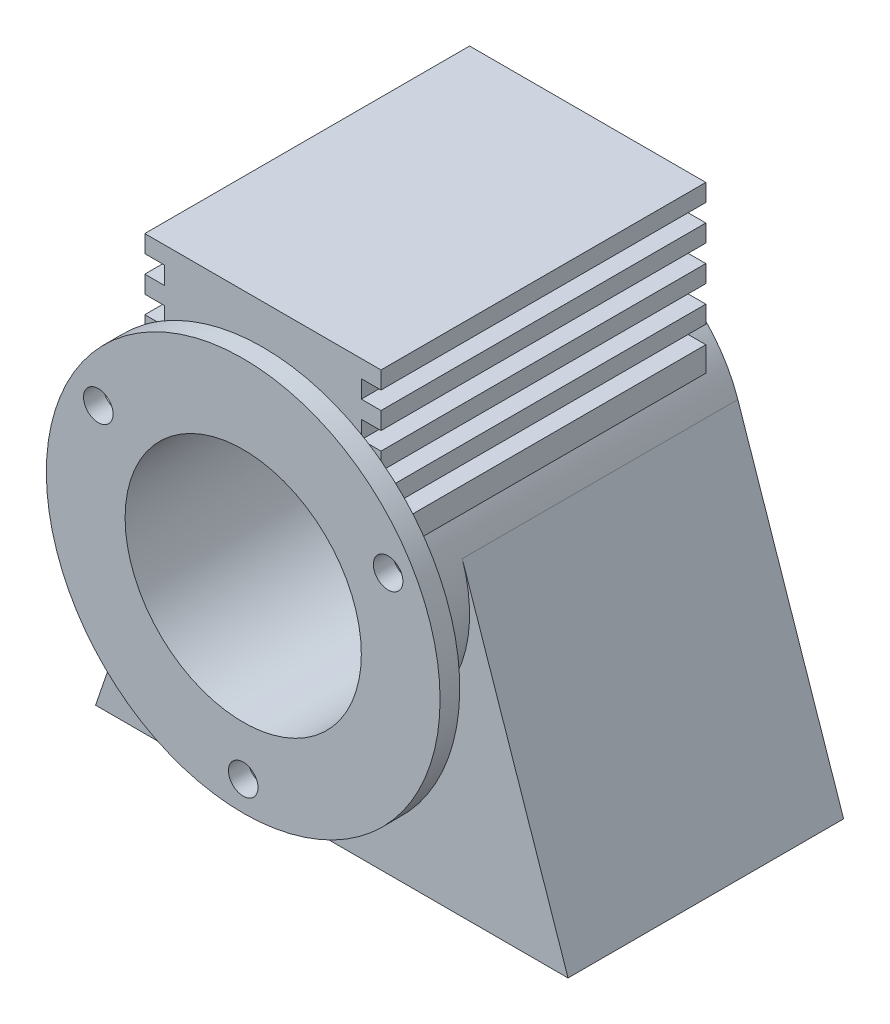
from build123d import *
from build123d.topology import SkipClean

# Parameters (mm, degrees)
BOSS_EXTRUDE1_DEPTH = 3.5
BOSS_EXTRUDE2_START = 1.75
SKETCH3_R           = 3.5
BOSS_EXTRUDE2_DEPTH = 1.75
BOSS_EXTRUDE3_START = 1.75
SKETCH3_3_R         = 5
BOSS_EXTRUDE3_DEPTH = 0.5
SKETCH4_R           = 3
CUT_EXTRUDE2_DEPTH  = 8.25
SKETCH5_R           = 0.75
CUT_EXTRUDE3_DEPTH  = 8.25
BOSS_EXTRUDE4_DEPTH = 8.25
CUT_EXTRUDE4_REACH  = 18.856
SKETCH7_R           = 0.375


with BuildPart() as part:
    # Sketch1 → Boss-Extrude1 (new, symmetric)
    with BuildSketch(Plane.XY):
        with BuildLine():
            Line((-6, 0), (6, 0))
            Line((6, 0), (3.312648335, 7.879761483))
            ThreePointArc((3.312648335, 7.879761483), (0, 10.25), (-3.312648335, 7.879761483))
            Line((-3.312648335, 7.879761483), (-6, 0))
        make_face()
    extrude(amount=BOSS_EXTRUDE1_DEPTH, both=True)

    # Sketch3 → Boss-Extrude2 (add)
    with SkipClean():  # the faces are left unmerged after this step: merging them gives an invalid solid
        with BuildSketch(Plane.XY.offset(3.5).offset(BOSS_EXTRUDE2_START)):
            with Locations(Location((0, 6.75, 0), (0, 0, 161.168324383))):
                Circle(SKETCH3_R)
        extrude(amount=-BOSS_EXTRUDE2_DEPTH)

    # Sketch3<3> → Boss-Extrude3 (add)
    with BuildSketch(Plane.XY.offset(3.5).offset(BOSS_EXTRUDE3_START)):
        with Locations((0, 6.75)):
            Circle(SKETCH3_3_R)
    extrude(amount=BOSS_EXTRUDE3_DEPTH)

    # Sketch4 → Cut-Extrude2 (cut)
    with SkipClean():  # the faces are left unmerged after this step: merging them gives an invalid solid
        with BuildSketch(Plane.XY.offset(5.75)):
            with Locations((0, 6.75)):
                Circle(SKETCH4_R)
        extrude(amount=-CUT_EXTRUDE2_DEPTH, mode=Mode.SUBTRACT)

    # Sketch5 → Cut-Extrude3 (cut)
    with SkipClean():  # the faces are left unmerged after this step: merging them gives an invalid solid
        with BuildSketch(Plane(origin=(0, 0, -3.5), x_dir=(-1, 0, 0), z_dir=(0, 0, -1))):
            with Locations((0, 6.75)):
                Circle(SKETCH5_R)
        extrude(amount=-CUT_EXTRUDE3_DEPTH, mode=Mode.SUBTRACT)

    # Sketch6 → Boss-Extrude4 (add)
    with SkipClean():  # the faces are left unmerged after this step: merging them gives an invalid solid
        with BuildSketch(Plane(origin=(0, 0, 5.25), x_dir=(-1, 0, 0), z_dir=(0, 0, -1))):
            with BuildLine():
                Line((3, 12.75), (-3, 12.75))
                Line((-3, 12.75), (-3, 12.3075))
                Line((-3, 12.3075), (-2.5, 12.3075))
                Line((-2.5, 12.3075), (-2.5, 11.8575))
                Line((-2.5, 11.8575), (-3, 11.8575))
                Line((-3, 11.8575), (-3, 11.415))
                Line((-3, 11.415), (-2.5, 11.415))
                Line((-2.5, 11.415), (-2.5, 10.965))
                Line((-2.5, 10.965), (-3, 10.965))
                Line((-3, 10.965), (-3, 10.5225))
                Line((-3, 10.5225), (-2.5, 10.5225))
                Line((-2.5, 10.5225), (-2.5, 10.0725))
                Line((-2.5, 10.0725), (-3, 10.0725))
                Line((-3, 10.0725), (-3, 9.63))
                Line((-3, 9.63), (-2.5, 9.63))
                Line((-2.5, 9.63), (-2.5, 9.199489743))
                ThreePointArc((-2.5, 9.199489743), (0, 10.25), (2.5, 9.199489743))
                Line((2.5, 9.199489743), (2.5, 9.63))
                Line((2.5, 9.63), (3, 9.63))
                Line((3, 9.63), (3, 10.0725))
                Line((3, 10.0725), (2.5, 10.0725))
                Line((2.5, 10.0725), (2.5, 10.5225))
                Line((2.5, 10.5225), (3, 10.5225))
                Line((3, 10.5225), (3, 10.965))
                Line((3, 10.965), (2.5, 10.965))
                Line((2.5, 10.965), (2.5, 11.415))
                Line((2.5, 11.415), (3, 11.415))
                Line((3, 11.415), (3, 11.8575))
                Line((3, 11.8575), (2.5, 11.8575))
                Line((2.5, 11.8575), (2.5, 12.3075))
                Line((2.5, 12.3075), (3, 12.3075))
                Line((3, 12.3075), (3, 12.75))
            make_face()
            with BuildLine():
                Line((3, 9.18), (2.518948193, 9.18))
                ThreePointArc((2.518948193, 9.18), (2.777237817, 8.880011763), (3, 8.552775638))
                Line((3, 8.552775638), (3, 9.18))
            make_face()
            with BuildLine():
                ThreePointArc((-3, 8.552775638), (-2.777237817, 8.880011763), (-2.518948193, 9.18))
                Line((-2.518948193, 9.18), (-3, 9.18))
                Line((-3, 9.18), (-3, 8.552775638))
            make_face()
        extrude(amount=BOSS_EXTRUDE4_DEPTH)

    # Sketch7 → Cut-Extrude4 (cut, up to next)
    with BuildSketch(Plane.XY.offset(5.75), mode=Mode.PRIVATE) as cut_extrude4_sk1:
        with Locations((0, 2.5)):
            Circle(SKETCH7_R)
    cut_extrude4_tool1 = extrude(cut_extrude4_sk1.sketch, amount=-CUT_EXTRUDE4_REACH, mode=Mode.PRIVATE) & part.part
    # Sketch7 → Cut-Extrude4 (cut, up to next)
    with BuildSketch(Plane.XY.offset(5.75), mode=Mode.PRIVATE) as cut_extrude4_sk2:
        with Locations((3.680607966, 8.875)):
            Circle(SKETCH7_R)
    cut_extrude4_tool2 = extrude(cut_extrude4_sk2.sketch, amount=-CUT_EXTRUDE4_REACH, mode=Mode.PRIVATE) & part.part
    # Sketch7 → Cut-Extrude4 (cut, up to next)
    with BuildSketch(Plane.XY.offset(5.75), mode=Mode.PRIVATE) as cut_extrude4_sk3:
        with Locations((-3.680607966, 8.875)):
            Circle(SKETCH7_R)
    cut_extrude4_tool3 = extrude(cut_extrude4_sk3.sketch, amount=-CUT_EXTRUDE4_REACH, mode=Mode.PRIVATE) & part.part
    add(cut_extrude4_tool1.solids().sort_by_distance((0, 2.5, 5.75))[0], mode=Mode.SUBTRACT)
    add(cut_extrude4_tool2.solids().sort_by_distance((3.680608, 8.875, 5.75))[0], mode=Mode.SUBTRACT)
    add(cut_extrude4_tool3.solids().sort_by_distance((-3.680608, 8.875, 5.75))[0], mode=Mode.SUBTRACT)


solid = part.part
